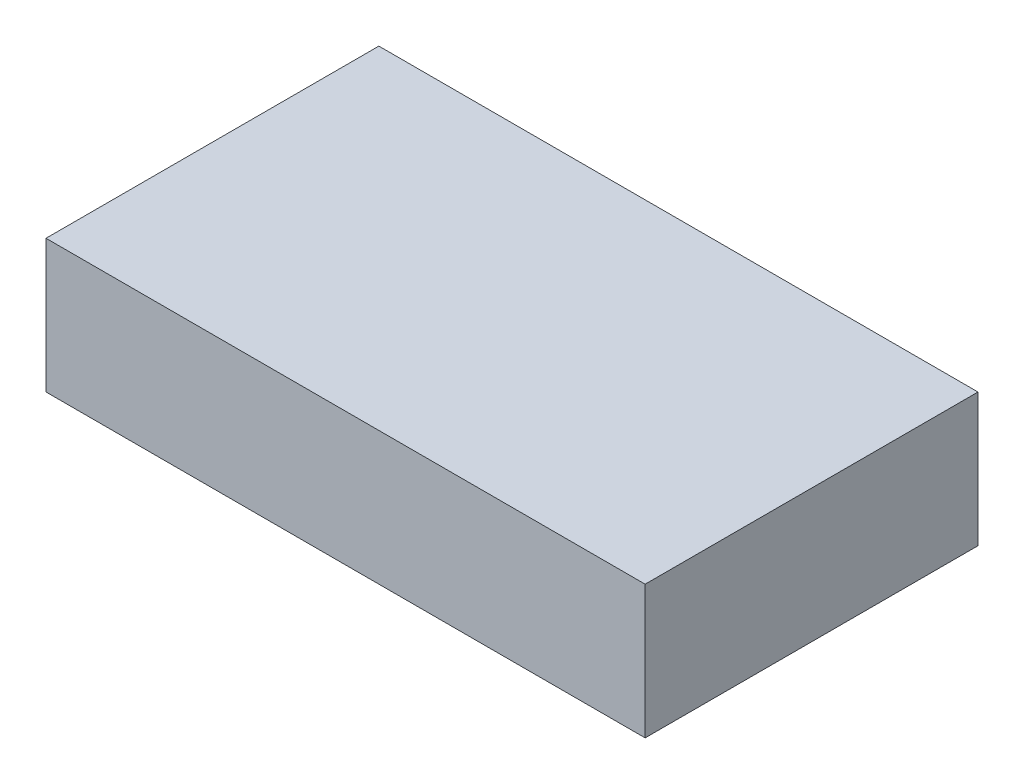
from build123d import *

# Parameters (mm, degrees)
SKETCH1_W           = 27
SKETCH1_H           = 15
BOSS_EXTRUDE1_DEPTH = 6


with BuildPart() as part:
    # Sketch1 → Boss-Extrude1 (new body)
    with BuildSketch(Plane(origin=(0, 0, 0), x_dir=(1, 0, 0), z_dir=(0, 1, 0))):
        Rectangle(SKETCH1_W, SKETCH1_H)
    extrude(amount=BOSS_EXTRUDE1_DEPTH)


solid = part.part
